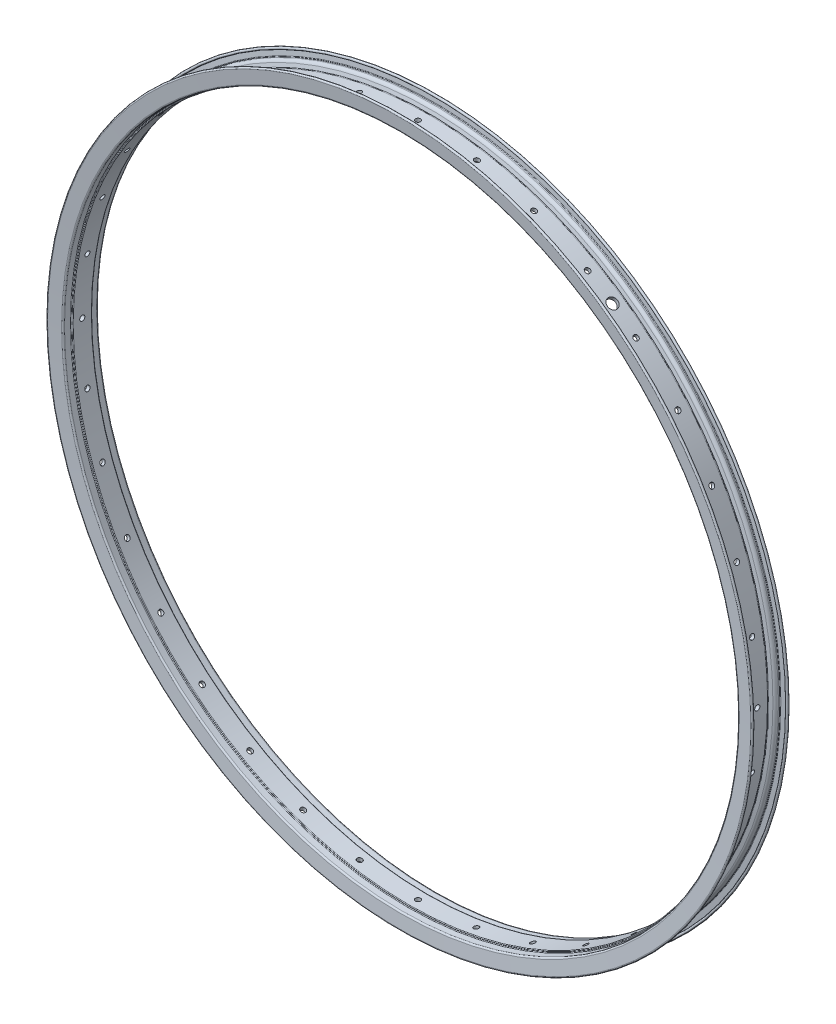
from build123d import *

# Parameters (mm, degrees)
CROQUIS2_R                 = 2.1
CORTAR_EXTRUIR1_DEPTH      = 408.724146468
MATRIZC1_COUNT             = 36
CORTAR_EXTRUIR2_REACH      = 684.001
CORTAR_EXTRUIR2_END_RADIUS = 274
CROQUIS4_R                 = 4.2


with BuildPart() as part:
    # Croquis1 → Revolución1 (revolve)
    with BuildSketch(Plane(origin=(0, 0, 0), x_dir=(0, 0, -1), z_dir=(1, 0, 0)), mode=Mode.PRIVATE) as revoluci_n1_sk:
        with BuildLine():
            Line((7.359611797, 274), (-7.359611797, 274))
            ThreePointArc((-7.359611797, 274), (-7.753714516, 274.192293895), (-7.844683047, 274.621267813))
            Line((-7.844683047, 274.621267813), (-7.805316953, 274.778732187))
            ThreePointArc((-7.805316953, 274.778732187), (-7.896285484, 275.207706105), (-8.290388203, 275.4))
            Line((-8.290388203, 275.4), (-13.112874711, 275.4))
            ThreePointArc((-13.112874711, 275.4), (-13.954024128, 275.725355388), (-14.357297553, 276.532051747))
            Line((-14.357297553, 276.532051747), (-15.35, 287.005641398))
            ThreePointArc((-15.35, 287.005641398), (-13.71723147, 287.870673472), (-14.260103124, 286.104461726))
            Line((-14.260103124, 286.104461726), (-13.897247491, 282.276123215))
            ThreePointArc((-13.897247491, 282.276123215), (-13.735938121, 281.953444672), (-13.399478354, 281.823302516))
            Line((-13.399478354, 281.823302516), (-12.399478354, 281.823302516))
            ThreePointArc((-12.399478354, 281.823302516), (-10.783934578, 281.298727938), (-9.784734943, 279.925134013))
            Line((-9.784734943, 279.925134013), (-8.912433749, 277.247557742))
            ThreePointArc((-8.912433749, 277.247557742), (-8.730761088, 276.997813391), (-8.437025856, 276.902436195))
            Line((-8.437025856, 276.902436195), (8.437025856, 276.902436195))
            ThreePointArc((8.437025856, 276.902436195), (8.730761088, 276.997813391), (8.912433749, 277.247557742))
            Line((8.912433749, 277.247557742), (9.784734943, 279.925134013))
            ThreePointArc((9.784734943, 279.925134013), (10.783934578, 281.298727938), (12.399478354, 281.823302516))
            Line((12.399478354, 281.823302516), (13.399478354, 281.823302516))
            ThreePointArc((13.399478354, 281.823302516), (13.735938121, 281.953444672), (13.897247491, 282.276123215))
            Line((13.897247491, 282.276123215), (14.260103124, 286.104461726))
            ThreePointArc((14.260103124, 286.104461726), (13.71723147, 287.870673472), (15.35, 287.005641398))
            Line((15.35, 287.005641398), (14.357297553, 276.532051747))
            ThreePointArc((14.357297553, 276.532051747), (13.954024128, 275.725355388), (13.112874711, 275.4))
            Line((13.112874711, 275.4), (8.290388203, 275.4))
            ThreePointArc((8.290388203, 275.4), (7.896285484, 275.207706105), (7.805316953, 274.778732187))
            Line((7.805316953, 274.778732187), (7.844683047, 274.621267813))
            ThreePointArc((7.844683047, 274.621267813), (7.753714516, 274.192293895), (7.359611797, 274))
        make_face()
    revolve(revoluci_n1_sk.sketch.rotate(Axis((0, 0, 255.624615883), (0, 0, -1)), 90), axis=Axis((0, 0, 255.624615883), (0, 0, -1)))

    # Croquis2 → Cortar-Extruir1 (cut, through all)
    with BuildSketch(Plane(origin=(0, 0, 0), x_dir=(1, 0, 0), z_dir=(0, 1, 0))):
        with Locations(Location((0, 0, 0), (0, 0, 270))):
            Circle(CROQUIS2_R)
    cortar_extruir1 = extrude(amount=-CORTAR_EXTRUIR1_DEPTH, mode=Mode.SUBTRACT)

    # MatrizC1: Cortar-Extruir1 ×36 about axis
    matrizc1_axis = Axis((0, 0, -7.359611797), (0, 0, 1))
    for i in range(1, MATRIZC1_COUNT):
        add(cortar_extruir1.rotate(matrizc1_axis, i * 360 / MATRIZC1_COUNT), mode=Mode.SUBTRACT)

    # Cortar-Extruir2: up to this cylinder (the profile starts outside it)
    cortar_extruir2_end = Plane(origin=(0, 0, 0), z_dir=(0, 0, 1)) * Cylinder(CORTAR_EXTRUIR2_END_RADIUS, 1917.002, mode=Mode.PRIVATE)
    # Croquis4 → Cortar-Extruir2 (cut, up to the surface)
    with BuildSketch(Plane(origin=(158.824712853, 226.825197101, 0), x_dir=(0.8191520443100039, -0.5735764363210377, 0), z_dir=(0.5735764363210377, 0.8191520443100039, 0)), mode=Mode.PRIVATE) as cortar_extruir2_sk1:
        with Locations(Location((0, 0, 0), (0, 0, 180))):
            Circle(CROQUIS4_R)
    cortar_extruir2_tool1 = extrude(cortar_extruir2_sk1.sketch, amount=-CORTAR_EXTRUIR2_REACH, mode=Mode.PRIVATE) - cortar_extruir2_end
    add(cortar_extruir2_tool1.solids().sort_by_distance((158.824713, 226.825197, 0))[0], mode=Mode.SUBTRACT)


solid = part.part
